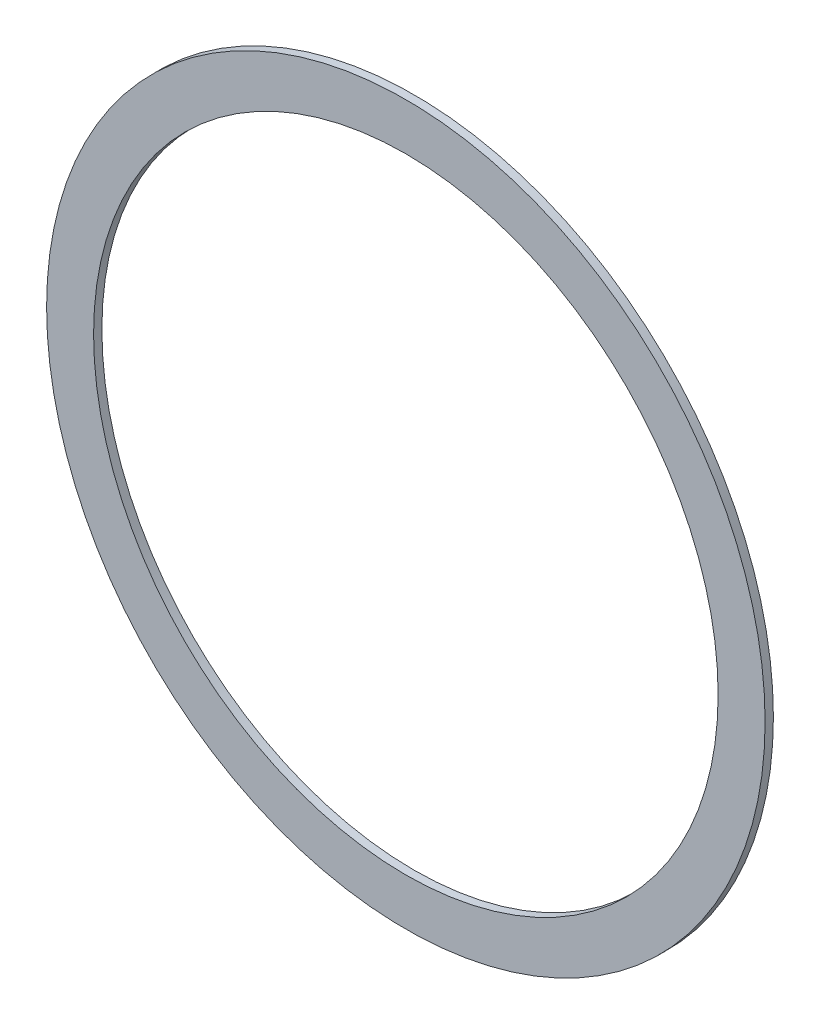
from build123d import *

# Parameters (mm, degrees)
EXTRUDE_START   = 11.5
SKETCH_1_R      = 65
SKETCH_1_R_2    = 56.5
EXTRUDE_1_DEPTH = 1.5


with BuildPart() as part:
    # 草圖1 → 填料-伸長1 (new body)
    with BuildSketch(Plane.XY.offset(EXTRUDE_START)):
        Circle(SKETCH_1_R)
        Circle(SKETCH_1_R_2, mode=Mode.SUBTRACT)
    extrude(amount=EXTRUDE_1_DEPTH)


solid = part.part
